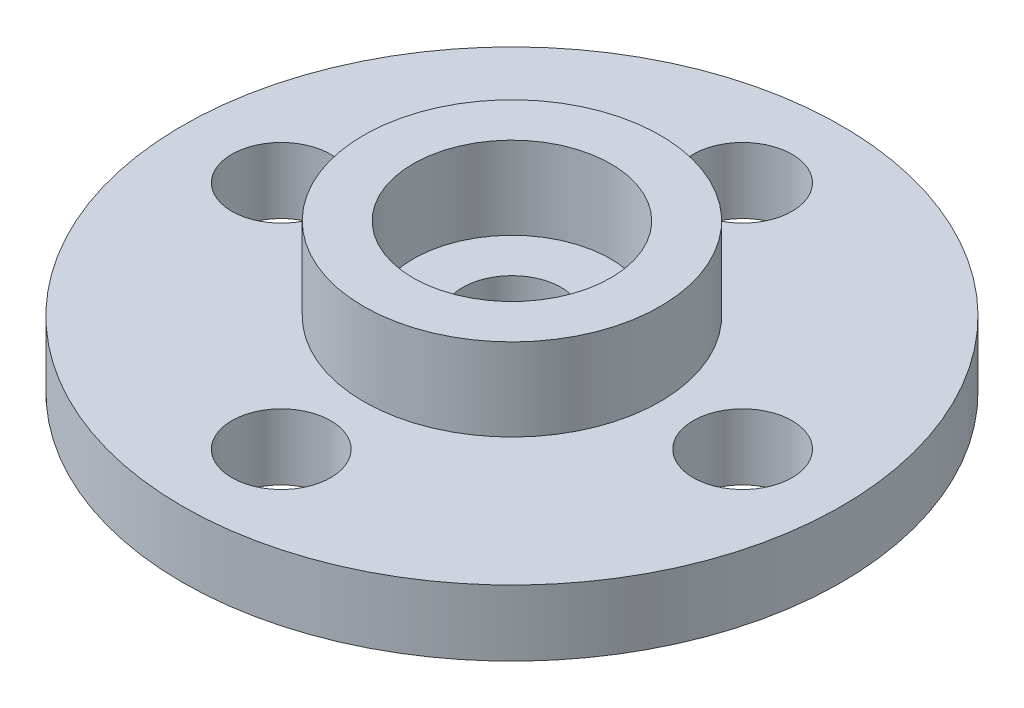
from build123d import *

# Parameters (mm, degrees)
SKETCH1_R           = 10
SKETCH1_R_2         = 1.5
BOSS_EXTRUDE1_DEPTH = 2
SKETCH2_R           = 4.5
SKETCH2_R_2         = 3
BOSS_EXTRUDE2_DEPTH = 2.5


with BuildPart() as part:
    # Sketch1 → Boss-Extrude1 (new body)
    with BuildSketch(Plane(origin=(0, 0, 0), x_dir=(1, 0, 0), z_dir=(0, 1, 0))):
        with Locations(Location((0, 0, 0), (0, 0, 270))):
            Circle(SKETCH1_R)
        with Locations(Location((0, -7, 0), (0, 0, 270))):
            Circle(SKETCH1_R_2, mode=Mode.SUBTRACT)
        with Locations(Location((-7, 0, 0), (0, 0, 270))):
            Circle(SKETCH1_R_2, mode=Mode.SUBTRACT)
        with Locations(Location((0, 7, 0), (0, 0, 270))):
            Circle(SKETCH1_R_2, mode=Mode.SUBTRACT)
        with Locations(Location((7, 0, 0), (0, 0, 270))):
            Circle(SKETCH1_R_2, mode=Mode.SUBTRACT)
        with Locations(Location((0, 0, 0), (0, 0, 270))):
            Circle(SKETCH1_R_2, mode=Mode.SUBTRACT)
    extrude(amount=BOSS_EXTRUDE1_DEPTH)

    # Sketch2 → Boss-Extrude2 (add)
    with BuildSketch(Plane(origin=(0, 2, 0), x_dir=(1, 0, 0), z_dir=(0, 1, 0))):
        with Locations(Location((0, 0, 0), (0, 0, 270))):
            Circle(SKETCH2_R)
        with Locations(Location((0, 0, 0), (0, 0, 270))):
            Circle(SKETCH2_R_2, mode=Mode.SUBTRACT)
    extrude(amount=BOSS_EXTRUDE2_DEPTH)


solid = part.part
